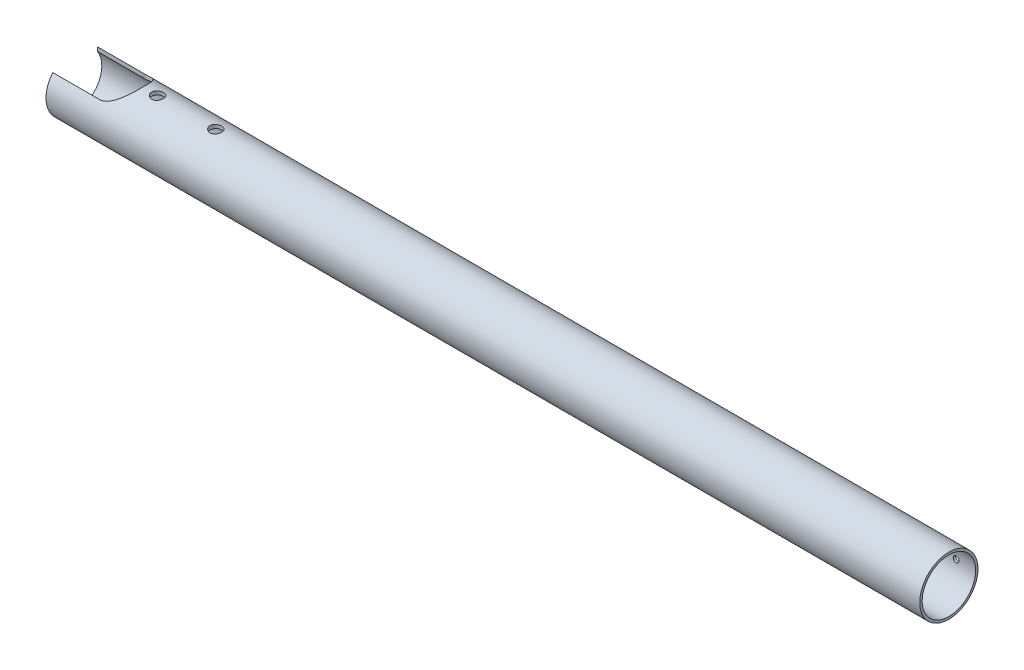
from build123d import *

# Parameters (mm, degrees)
ESQUISSE1_R             = 30
BASE_EXTRUSION_DEPTH    = 900
COQUE1_T                = -2.5
ENL_V_MAT_EXTRU_1_DEPTH = 100
ESQUISSE4_W             = 89
ESQUISSE4_H             = 20
BOSS_EXTRU_1_DEPTH      = 2
ESQUISSE3_R             = 6
ENL_V_MAT_EXTRU_2_DEPTH = 100
ESQUISSE6_R             = 3
ENL_V_MAT_EXTRU_3_DEPTH = 50


with BuildPart() as part:
    # Esquisse1 → Base-Extrusion (new body)
    with BuildSketch(Plane(origin=(0, 0, 0), x_dir=(0, 0, -1), z_dir=(1, 0, 0))):
        with Locations(Location((0, 0, 0), (0, 0, 140.05549481))):
            Circle(ESQUISSE1_R)
    extrude(amount=BASE_EXTRUSION_DEPTH)

    # Coque1
    coque1_openings = [part.faces().sort_by_distance(p)[0] for p in [
        (0, 0, 0),
        (900, 0, 0),
    ]]
    offset(amount=COQUE1_T, openings=coque1_openings, kind=Kind.INTERSECTION)

    # Esquisse2 → Enlèv. mat.-Extru.1 (cut)
    with BuildSketch(Plane(origin=(0, 0, 0), x_dir=(1, 0, 0), z_dir=(0, 1, 0))):
        with BuildLine():
            Line((-10, 23), (48, 23))
            ThreePointArc((48, 23), (63.556349186, 16.556349186), (70, 1))
            Line((70, 1), (70, -1))
            ThreePointArc((70, -1), (63.556349186, -16.556349186), (48, -23))
            Line((48, -23), (-10, -23))
            Line((-10, -23), (-10, 23))
        make_face()
    extrude(amount=ENL_V_MAT_EXTRU_1_DEPTH, mode=Mode.SUBTRACT)

    # Esquisse4 → Boss.-Extru.1 (add)
    with BuildSketch(Plane(origin=(0, 26, 0), x_dir=(-1, 0, 0), z_dir=(0, 1, 0))):
        with Locations((-115.5, 0)):
            Rectangle(ESQUISSE4_W, ESQUISSE4_H)
    extrude(amount=BOSS_EXTRU_1_DEPTH)

    # Esquisse3 → Enlèv. mat.-Extru.2 (cut)
    with BuildSketch(Plane(origin=(0, 0, 0), x_dir=(1, 0, 0), z_dir=(0, 1, 0))):
        with Locations(Location((85, 0, 0), (0, 0, 90))):
            Circle(ESQUISSE3_R)
        with Locations(Location((145, 0, 0), (0, 0, 90))):
            Circle(ESQUISSE3_R)
    extrude(amount=ENL_V_MAT_EXTRU_2_DEPTH, mode=Mode.SUBTRACT)

    # Esquisse6 → Enlèv. mat.-Extru.3 (cut)
    with BuildSketch(Plane.XY):
        with Locations((880, 0)):
            Circle(ESQUISSE6_R)
    extrude(amount=-ENL_V_MAT_EXTRU_3_DEPTH, mode=Mode.SUBTRACT)


solid = part.part
